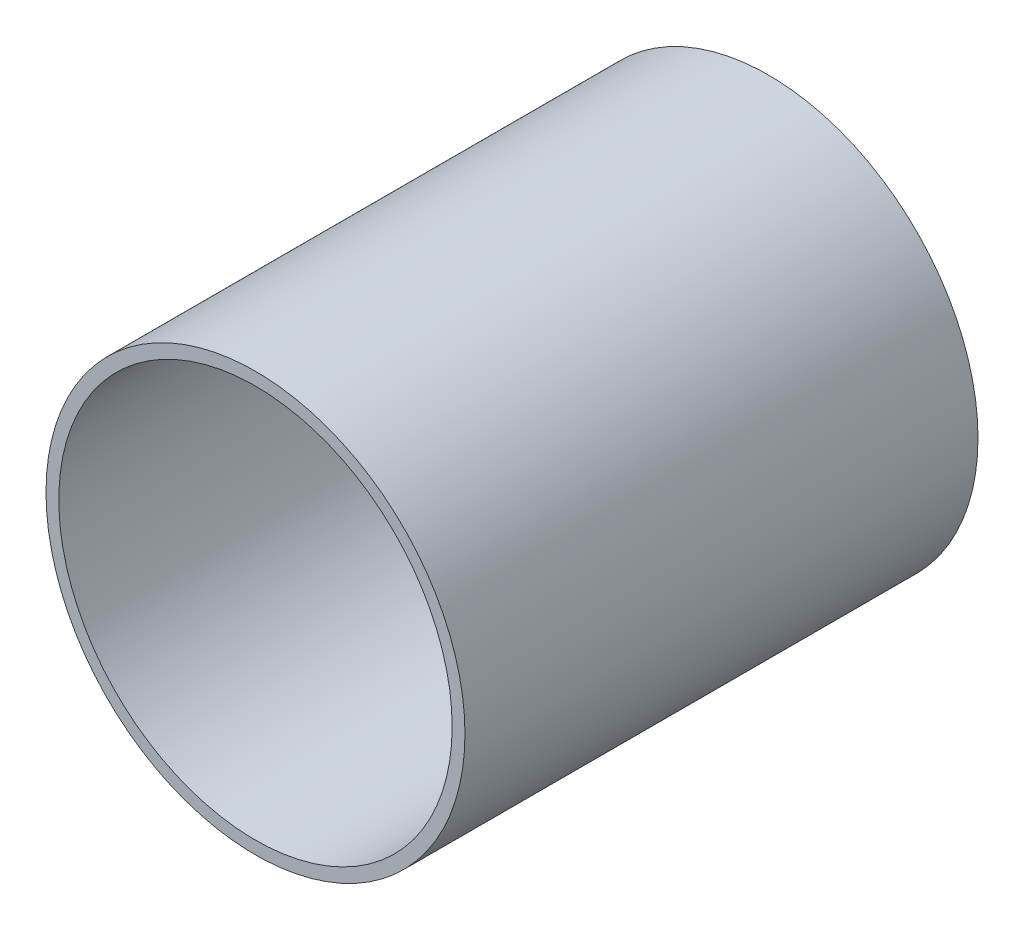
from build123d import *

# Parameters (mm, degrees)
SKETCH1_R           = 2.45
BOSS_EXTRUDE1_DEPTH = 6
SKETCH2_R           = 2.3
CUT_EXTRUDE1_DEPTH  = 5.75


with BuildPart() as part:
    # Sketch1 → Boss-Extrude1 (new body)
    with BuildSketch(Plane.XY):
        Circle(SKETCH1_R)
    extrude(amount=BOSS_EXTRUDE1_DEPTH)

    # Sketch2 → Cut-Extrude1 (cut)
    with BuildSketch(Plane.XY.offset(6)):
        Circle(SKETCH2_R)
    extrude(amount=-CUT_EXTRUDE1_DEPTH, mode=Mode.SUBTRACT)


solid = part.part
